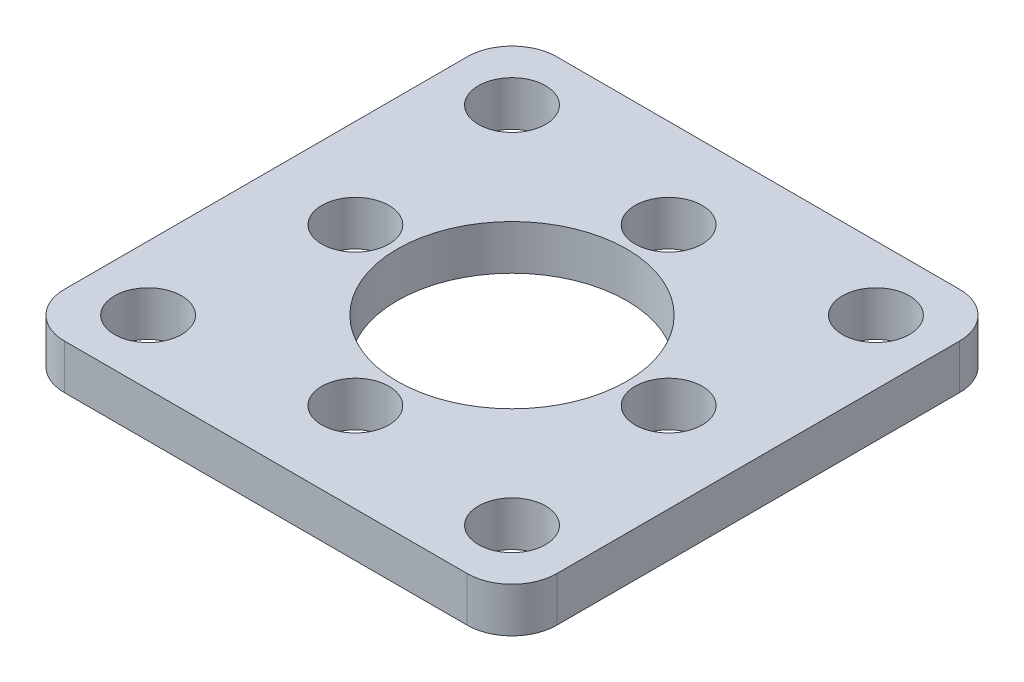
from build123d import *

# Parameters (mm, degrees)
SKETCH_1_W          = 22.002454374
SKETCH_1_H          = 22.002454374
SKETCH_1_R          = 1.5
EXTRUDE_1_DEPTH     = 2
FILLET_1_R          = 2
SKETCH_3_R          = 1.5
CUT_EXTRUDE_2_DEPTH = 10
SKETCH_4_R          = 5.125
CUT_EXTRUDE_3_DEPTH = 10


with BuildPart() as part:
    # 草图1 → 凸台-拉伸1 (new body)
    with BuildSketch(Plane(origin=(0, 0, 0), x_dir=(1, 0, 0), z_dir=(0, 1, 0))):
        Rectangle(SKETCH_1_W, SKETCH_1_H)
        with Locations(Location((-8.131727984, 8.131727984, 0), (0, 0, 270))):
            Circle(SKETCH_1_R, mode=Mode.SUBTRACT)
        with Locations(Location((8.131727984, -8.131727984, 0), (0, 0, 90))):
            Circle(SKETCH_1_R, mode=Mode.SUBTRACT)
        with Locations(Location((8.131727984, 8.131727984, 0), (0, 0, 270))):
            Circle(SKETCH_1_R, mode=Mode.SUBTRACT)
        with Locations(Location((-8.131727984, -8.131727984, 0), (0, 0, 90))):
            Circle(SKETCH_1_R, mode=Mode.SUBTRACT)
    extrude(amount=EXTRUDE_1_DEPTH)

    # 圆角1
    fillet_1_edges = [part.edges().sort_by_distance(p)[0] for p in [
        (11.001227187, 1, 11.001227187),
        (-11.001227187, 1, 11.001227187),
        (-11.001227187, 1, -11.001227187),
        (11.001227187, 1, -11.001227187),
    ]]
    fillet(fillet_1_edges, radius=FILLET_1_R)

    # 草图3 → 切除-拉伸2 (cut)
    with BuildSketch(Plane(origin=(0, 0, 0), x_dir=(1, 0, 0), z_dir=(0, 1, 0))):
        with Locations(Location((-7, 0, 0), (0, 0, 270))):
            Circle(SKETCH_3_R)
        with Locations(Location((7, 0, 0), (0, 0, 90))):
            Circle(SKETCH_3_R)
        with Locations(Location((0, 7, 0), (0, 0, 270))):
            Circle(SKETCH_3_R)
        with Locations(Location((0, -7, 0), (0, 0, 90))):
            Circle(SKETCH_3_R)
    extrude(amount=CUT_EXTRUDE_2_DEPTH, mode=Mode.SUBTRACT)

    # 草图4 → 切除-拉伸3 (cut)
    with BuildSketch(Plane.XZ):
        with Locations(Location((0, 0, 0), (0, 0, 270))):
            Circle(SKETCH_4_R)
    extrude(amount=-CUT_EXTRUDE_3_DEPTH, mode=Mode.SUBTRACT)


solid = part.part
